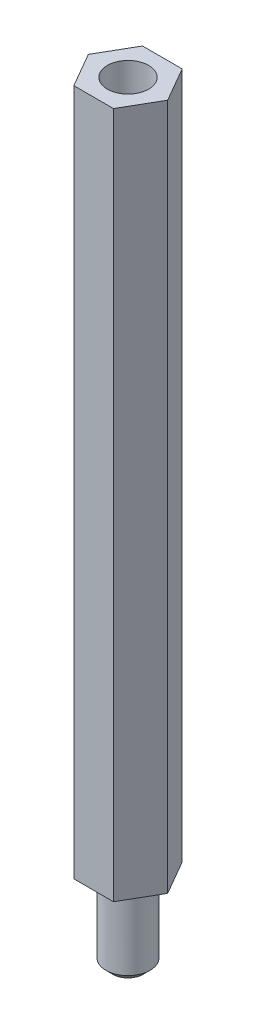
from build123d import *

# Parameters (mm, degrees)
SKETCH1_R           = 1.5
EXTRUDE1_DEPTH      = 50
EXTRUDE2_DEPTH      = 6
EXTRUDE2_DEPTH_BACK = 22
SKETCH2_R           = 1.6
CHAMFER1_SIZE       = 0.5
FILLET1_R           = 0.5
FILLET2_R           = 1


with BuildPart() as part:
    # Sketch1 → Extrude1 (new body)
    with BuildSketch(Plane(origin=(0, 0, 0), x_dir=(1, 0, 0), z_dir=(0, 1, 0))):
        Polygon((-1.443375673, 2.5), (1.443375673, 2.5), (2.886751346, 0), (1.443375673, -2.5), (-1.443375673, -2.5), (-2.886751346, 0), align=None)
        with Locations(Location((0, 0, 0), (0, 0, 270))):
            Circle(SKETCH1_R, mode=Mode.SUBTRACT)
    extrude(amount=EXTRUDE1_DEPTH)

    # Sketch2 → Extrude2 (add, two sides: drawn at the far end of the back side and taken through both)
    with BuildSketch(Plane.XZ.offset(-EXTRUDE2_DEPTH_BACK)):
        with Locations(Location((0, 0, 0), (0, 0, 270))):
            Circle(SKETCH2_R)
    extrude(amount=EXTRUDE2_DEPTH + EXTRUDE2_DEPTH_BACK)

    # Chamfer1
    chamfer1_edges = [part.edges().sort_by_distance(p)[0] for p in [
        (0, -6, 1.6),
    ]]
    chamfer(chamfer1_edges, length=CHAMFER1_SIZE)

    # Fillet1
    fillet1_edges = [part.edges().sort_by_distance(p)[0] for p in [
        (0, 0, 1.6),
    ]]
    fillet(fillet1_edges, radius=FILLET1_R)

    # Fillet2
    fillet2_edges = [part.edges().sort_by_distance(p)[0] for p in [
        (0, 22, -1.5),
    ]]
    fillet(fillet2_edges, radius=FILLET2_R)


solid = part.part
